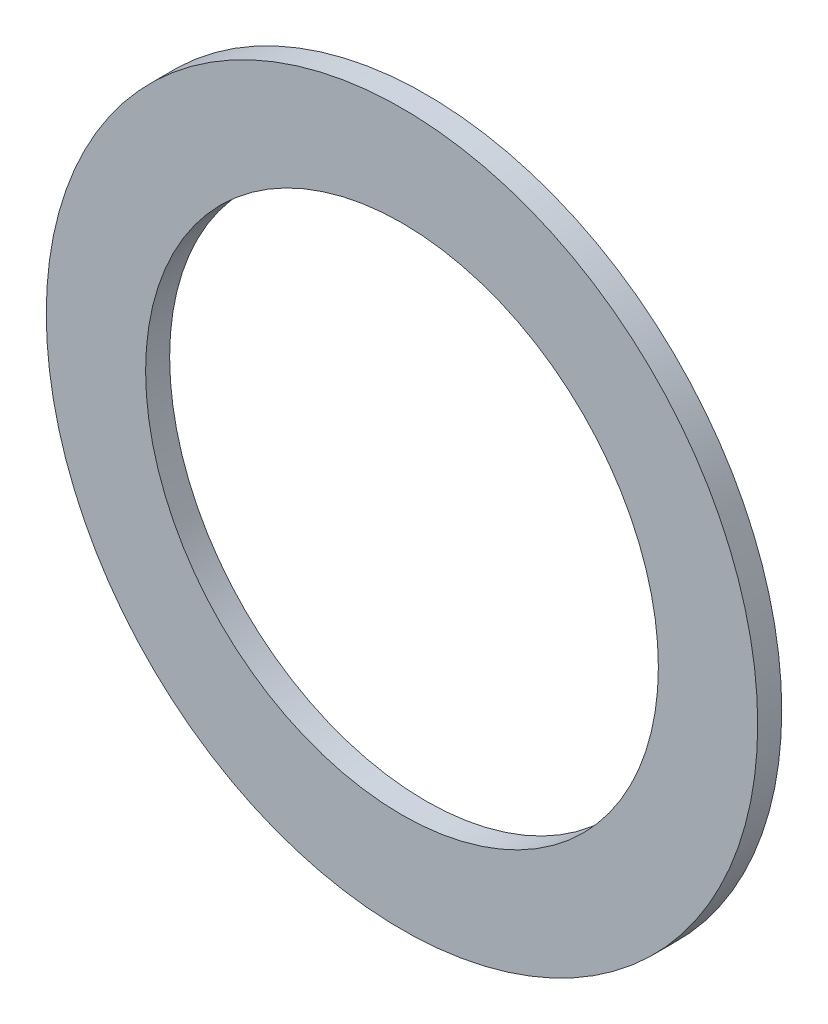
from build123d import *

# Parameters (mm, degrees)
STACK_WASHER_START = 15
SKETCH_1_R         = 22.2
SKETCH_1_R_2       = 16
STACK_WASHER_DEPTH = 1.5


with BuildPart() as part:
    # Эскиз1 → Stack_washer (new body)
    with BuildSketch(Plane.XY.offset(STACK_WASHER_START)):
        Circle(SKETCH_1_R)
        Circle(SKETCH_1_R_2, mode=Mode.SUBTRACT)
    extrude(amount=STACK_WASHER_DEPTH)


solid = part.part
